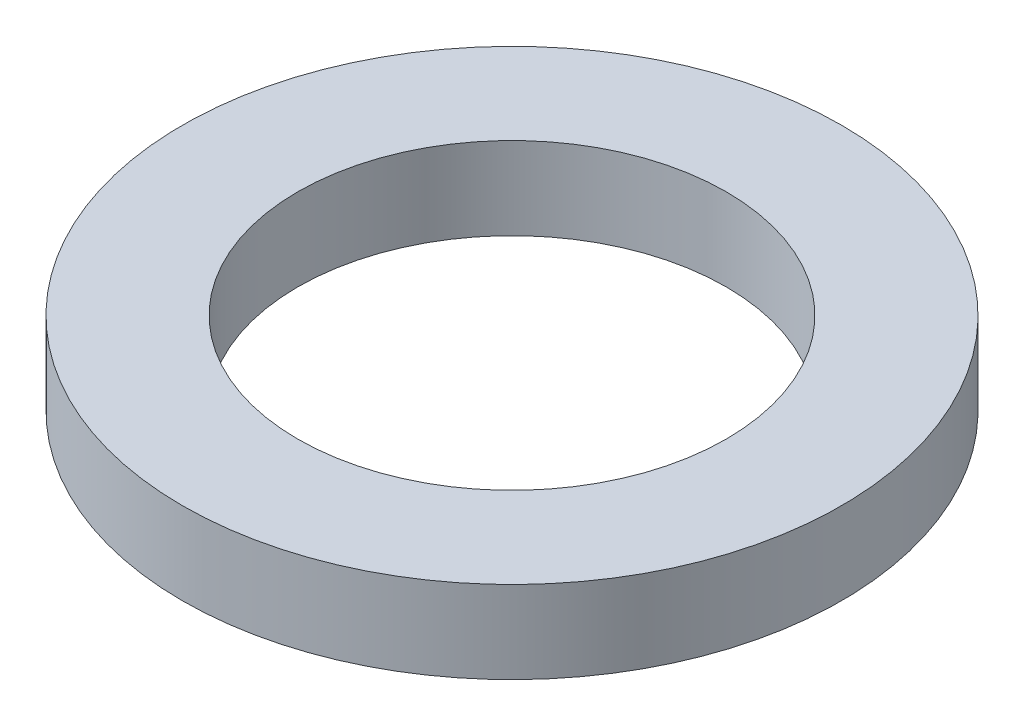
from build123d import *

# Parameters (mm, degrees)
SKETCH1_R           = 20
SKETCH1_R_2         = 13
BOSS_EXTRUDE1_DEPTH = 5


with BuildPart() as part:
    # Sketch1 → Boss-Extrude1 (new body)
    with BuildSketch(Plane(origin=(0, 0, 0), x_dir=(1, 0, 0), z_dir=(0, 1, 0))):
        with Locations(Location((0, 0, 0), (0, 0, 270))):
            Circle(SKETCH1_R)
        with Locations(Location((0, 0, 0), (0, 0, 270))):
            Circle(SKETCH1_R_2, mode=Mode.SUBTRACT)
    extrude(amount=BOSS_EXTRUDE1_DEPTH)


solid = part.part
